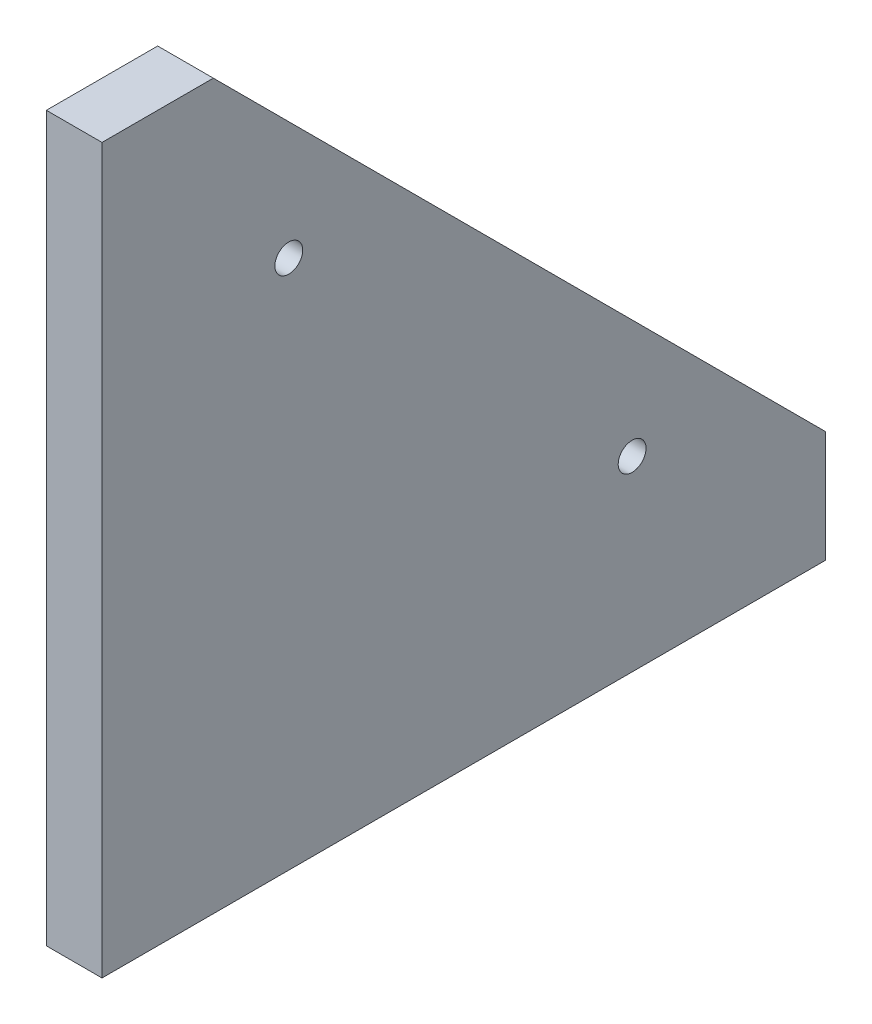
from build123d import *

# Parameters (mm, degrees)
BOSS_EXTRUDE1_DEPTH            = 2.5
F_2_5MM_DOWEL_HOLE1_AT_2_COUNT = 2
F_2_5MM_DOWEL_HOLE1_AT_2_PITCH = 43.617065155


with BuildPart() as part:
    # Sketch1 → Boss-Extrude1 (new, symmetric)
    with BuildSketch(Plane(origin=(0, 0, 0), x_dir=(0, 0, -1), z_dir=(1, 0, 0))):
        Polygon((0, 65), (0, 0), (65, 0), (65, 10), (10, 65), align=None)
    extrude(amount=BOSS_EXTRUDE1_DEPTH, both=True)

    # Sketch3 → Ø2.5mm Dowel Hole1 (revolve, cut)
    with BuildSketch(Plane(origin=(2.5, 47.617660414, -16.775737868), x_dir=(0, 0, -1), z_dir=(0, 1, 0))):
        Polygon((0, 0), (0, 5), (1.275, 5), (1.25, 4.975), (1.25, 0), align=None)
    f_2_5mm_dowel_hole1 = revolve(axis=Axis((8.85, 47.617660414, -16.775737868), (-1, 0, 0)), mode=Mode.SUBTRACT)

    # Ø2.5mm Dowel Hole1 at 2: Ø2.5mm Dowel Hole1 ×2
    with Locations(*[Vector(0, -0.7071067811865474, -0.7071067811865477) * (i * F_2_5MM_DOWEL_HOLE1_AT_2_PITCH) for i in range(1, F_2_5MM_DOWEL_HOLE1_AT_2_COUNT)]):
        add(f_2_5mm_dowel_hole1, mode=Mode.SUBTRACT)


solid = part.part
